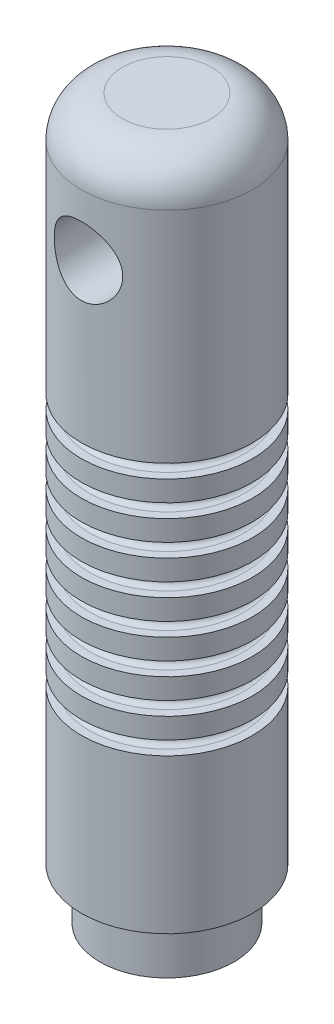
from build123d import *

# Parameters (mm, degrees)
LPATTERN1_COUNT         = 8
LPATTERN1_PITCH         = 6.35
SKETCH3_W               = 12.7
SKETCH3_H               = 2.4384
CUT_EXTRUDE1_DEPTH      = 19.05
CUT_EXTRUDE3_DEPTH      = 136.226675461
CUT_EXTRUDE3_DEPTH_BACK = 136.226675461
SKETCH4_R               = 6.35


with BuildPart() as part:
    # Sketch1 → Revolve1 (revolve)
    with BuildSketch(Plane.XY, mode=Mode.PRIVATE) as revolve1_sk:
        with BuildLine():
            Line((0, 0), (12.446, 0))
            Line((12.446, 0), (12.446, 9.525))
            Line((12.446, 9.525), (15.875, 9.525))
            Line((15.875, 9.525), (15.875, 125.73))
            ThreePointArc((15.875, 125.73), (13.643153673, 131.118153673), (8.255, 133.35))
            Line((8.255, 133.35), (0, 133.35))
            Line((0, 133.35), (0, 0))
        make_face()
    revolve(revolve1_sk.sketch.rotate(Axis((0, 80.351573735, 0), (0, -1, 0)), 90), axis=Axis((0, 80.351573735, 0), (0, -1, 0)))

    # Sketch2 → Cut-Revolve1 (revolve, cut)
    with BuildSketch(Plane.XY, mode=Mode.PRIVATE) as cut_revolve1_sk:
        with BuildLine():
            Line((15.875, 40.64), (14.351, 40.64))
            ThreePointArc((14.351, 40.64), (13.63257951, 40.34242049), (13.335, 39.624))
            Line((13.335, 39.624), (13.335, 39.116))
            ThreePointArc((13.335, 39.116), (13.63257951, 38.39757951), (14.351, 38.1))
            Line((14.351, 38.1), (15.875, 38.1))
            Line((15.875, 38.1), (15.875, 40.64))
        make_face()
    cut_revolve1 = revolve(cut_revolve1_sk.sketch.rotate(Axis((0, 121.228829799, 0), (0, -1, 0)), 90), axis=Axis((0, 121.228829799, 0), (0, -1, 0)), mode=Mode.SUBTRACT)

    # LPattern1: Cut-Revolve1 ×8
    with Locations(*[(0, i * LPATTERN1_PITCH, 0) for i in range(1, LPATTERN1_COUNT)]):
        add(cut_revolve1, mode=Mode.SUBTRACT)

    # Sketch3 → Cut-Extrude1 (cut)
    with BuildSketch(Plane.XZ):
        Rectangle(SKETCH3_W, SKETCH3_H)
    extrude(amount=-CUT_EXTRUDE1_DEPTH, mode=Mode.SUBTRACT)

    # Sketch4 → Cut-Extrude3 (cut, two sides: drawn at the far end of the back side and taken through both)
    with BuildSketch(Plane.XY.offset(-CUT_EXTRUDE3_DEPTH_BACK)):
        with Locations(Location((0, 114.3, 0), (0, 0, 90))):
            Circle(SKETCH4_R)
    extrude(amount=CUT_EXTRUDE3_DEPTH + CUT_EXTRUDE3_DEPTH_BACK, mode=Mode.SUBTRACT)


solid = part.part
